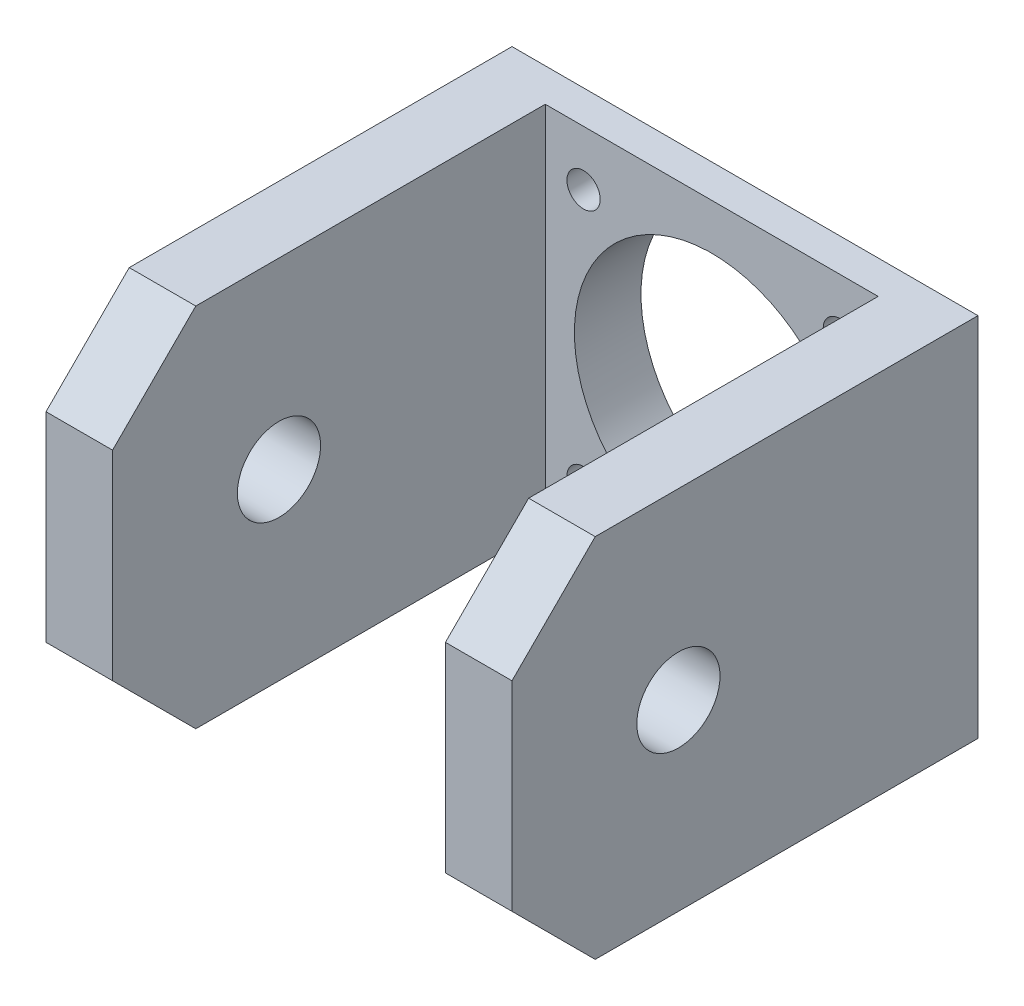
from build123d import *

# Parameters (mm, degrees)
SKETCH1_W           = 30
SKETCH1_H           = 22
BOSS_EXTRUDE1_DEPTH = 4
SKETCH2_W           = 4
SKETCH2_H           = 22
BOSS_EXTRUDE2_DEPTH = 20
SKETCH3_W           = 30
SKETCH3_H           = 22
BOSS_EXTRUDE3_DEPTH = 4
CHAMFER2_SIZE       = 5
SKETCH8_R           = 8.25
CUT_EXTRUDE1_DEPTH  = 4
SKETCH9_R           = 1
CUT_EXTRUDE2_DEPTH  = 4
CHAMFER3_SIZE       = 2
CUT_EXTRUDE3_REACH  = 48.562
SKETCH4_R           = 2.5


with BuildPart() as part:
    # Sketch1 → Boss-Extrude1 (new body)
    with BuildSketch(Plane(origin=(0, 0, 0), x_dir=(0, 0, -1), z_dir=(1, 0, 0))):
        with Locations((15, 11)):
            Rectangle(SKETCH1_W, SKETCH1_H)
    extrude(amount=BOSS_EXTRUDE1_DEPTH)

    # Sketch2 → Boss-Extrude2 (add)
    with BuildSketch(Plane.ZY):
        with Locations((-28, 11)):
            Rectangle(SKETCH2_W, SKETCH2_H)
    extrude(amount=BOSS_EXTRUDE2_DEPTH)

    # Sketch3 → Boss-Extrude3 (add)
    with BuildSketch(Plane.ZY.offset(20)):
        with Locations((-15, 11)):
            Rectangle(SKETCH3_W, SKETCH3_H)
    extrude(amount=BOSS_EXTRUDE3_DEPTH)

    # Chamfer2
    chamfer2_edges = [part.edges().sort_by_distance(p)[0] for p in [
        (-22, 22, 0),
        (-22, 0, 0),
        (2, 22, 0),
        (2, 0, 0),
    ]]
    chamfer(chamfer2_edges, length=CHAMFER2_SIZE)

    # Sketch8 → Cut-Extrude1 (cut)
    with BuildSketch(Plane.XY.offset(-26)):
        with Locations((-10, 11)):
            Circle(SKETCH8_R)
    extrude(amount=-CUT_EXTRUDE1_DEPTH, mode=Mode.SUBTRACT)

    # Sketch9 → Cut-Extrude2 (cut)
    with BuildSketch(Plane(origin=(0, 0, -30), x_dir=(-1, 0, 0), z_dir=(0, 0, -1))):
        with Locations((2.3, 18.7)):
            Circle(SKETCH9_R)
        with Locations((17.7, 18.7)):
            Circle(SKETCH9_R)
        with Locations((17.7, 3.3)):
            Circle(SKETCH9_R)
        with Locations((2.3, 3.3)):
            Circle(SKETCH9_R)
    extrude(amount=-CUT_EXTRUDE2_DEPTH, mode=Mode.SUBTRACT)

    # Chamfer3
    chamfer3_edges = [part.edges().sort_by_distance(p)[0] for p in [
        (4, 11, -30),
        (-24, 11, -30),
        (-10, 22, -30),
        (-10, 0, -30),
    ]]
    chamfer(chamfer3_edges, length=CHAMFER3_SIZE)

    # Cut-Extrude3: up to this face of the body (flat: up to its plane)
    cut_extrude3_end = Plane(part.part.faces().sort_by_distance((-24, 11, -14.521714608))[0])
    # Sketch4 → Cut-Extrude3 (cut, up to the picked face)
    with BuildSketch(Plane(origin=(4, 0, 0), x_dir=(0, 0, -1), z_dir=(1, 0, 0)), mode=Mode.PRIVATE) as cut_extrude3_sk1:
        with Locations(Location((10, 11, 0), (0, 0, 180))):
            Circle(SKETCH4_R)
    cut_extrude3_tool1 = split(extrude(cut_extrude3_sk1.sketch, amount=-CUT_EXTRUDE3_REACH, mode=Mode.PRIVATE), bisect_by=cut_extrude3_end, keep=Keep.BOTH, mode=Mode.PRIVATE)
    add(cut_extrude3_tool1.solids().sort_by(Axis((4, 11, -10), (-1, 0, 0)))[0], mode=Mode.SUBTRACT)


solid = part.part
